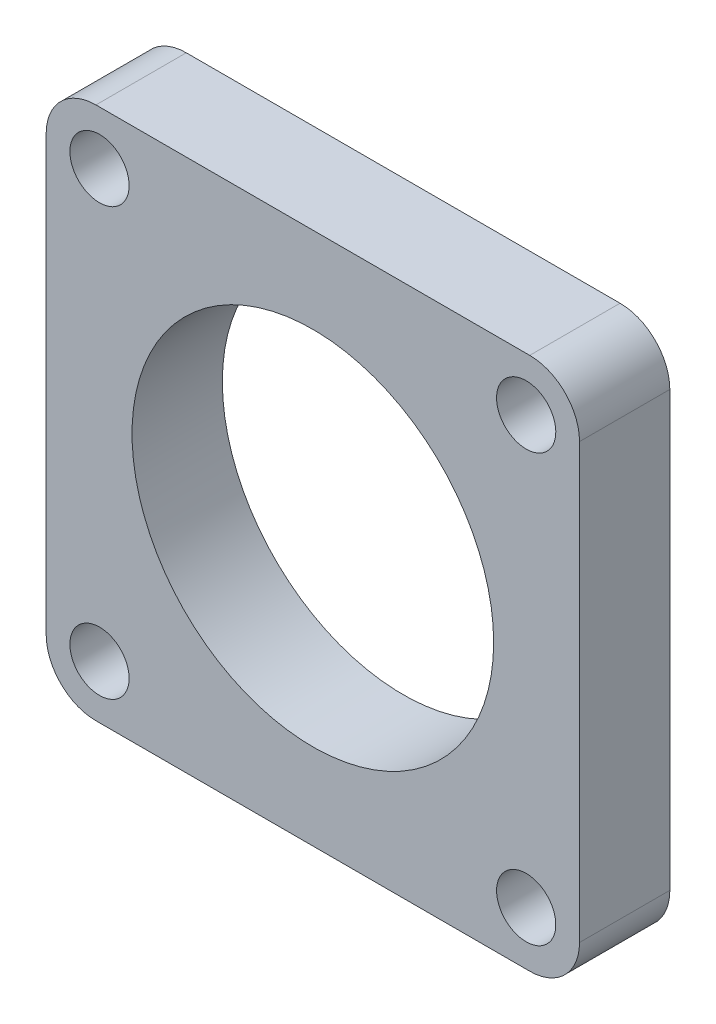
from build123d import *

# Parameters (mm, degrees)
SKETCH1_W           = 75
SKETCH1_H           = 75
BOSS_EXTRUDE1_DEPTH = 12.7
FILLET1_R           = 7
CUT_EXTRUDE1_REACH  = 56.532
SKETCH2_R           = 25.4254
CUT_EXTRUDE2_REACH  = 56.532
SKETCH3_R           = 4.165
CIRPATTERN1_COUNT   = 4


with BuildPart() as part:
    # Sketch1 → Boss-Extrude1 (new body)
    with BuildSketch(Plane.XY):
        Rectangle(SKETCH1_W, SKETCH1_H)
    extrude(amount=BOSS_EXTRUDE1_DEPTH)

    # Fillet1
    fillet1_edges = [part.edges().sort_by_distance(p)[0] for p in [
        (37.5, -37.5, 6.35),
        (-37.5, -37.5, 6.35),
        (-37.5, 37.5, 6.35),
        (37.5, 37.5, 6.35),
    ]]
    fillet(fillet1_edges, radius=FILLET1_R)

    # Sketch2 → Cut-Extrude1 (cut, up to next)
    with BuildSketch(Plane.XY.offset(12.7), mode=Mode.PRIVATE) as cut_extrude1_sk1:
        Circle(SKETCH2_R)
    cut_extrude1_tool1 = extrude(cut_extrude1_sk1.sketch, amount=-CUT_EXTRUDE1_REACH, mode=Mode.PRIVATE) & part.part
    add(cut_extrude1_tool1.solids().sort_by_distance((0, 0, 12.7))[0], mode=Mode.SUBTRACT)

    # Sketch3 → Cut-Extrude2 (cut, up to next)
    with BuildSketch(Plane.XY.offset(12.7), mode=Mode.PRIVATE) as cut_extrude2_sk1:
        with Locations((-30, 30)):
            Circle(SKETCH3_R)
    cut_extrude2_tool1 = extrude(cut_extrude2_sk1.sketch, amount=-CUT_EXTRUDE2_REACH, mode=Mode.PRIVATE) & part.part
    cut_extrude2 = cut_extrude2_tool1.solids().sort_by_distance((-30, 30, 12.7))[0]
    add(cut_extrude2, mode=Mode.SUBTRACT)

    # CirPattern1: Cut-Extrude2 ×4 about axis
    cirpattern1_axis = Axis((0, 0, 0), (0, 0, 1))
    for i in range(1, CIRPATTERN1_COUNT):
        add(cut_extrude2.rotate(cirpattern1_axis, i * 360 / CIRPATTERN1_COUNT), mode=Mode.SUBTRACT)


solid = part.part
